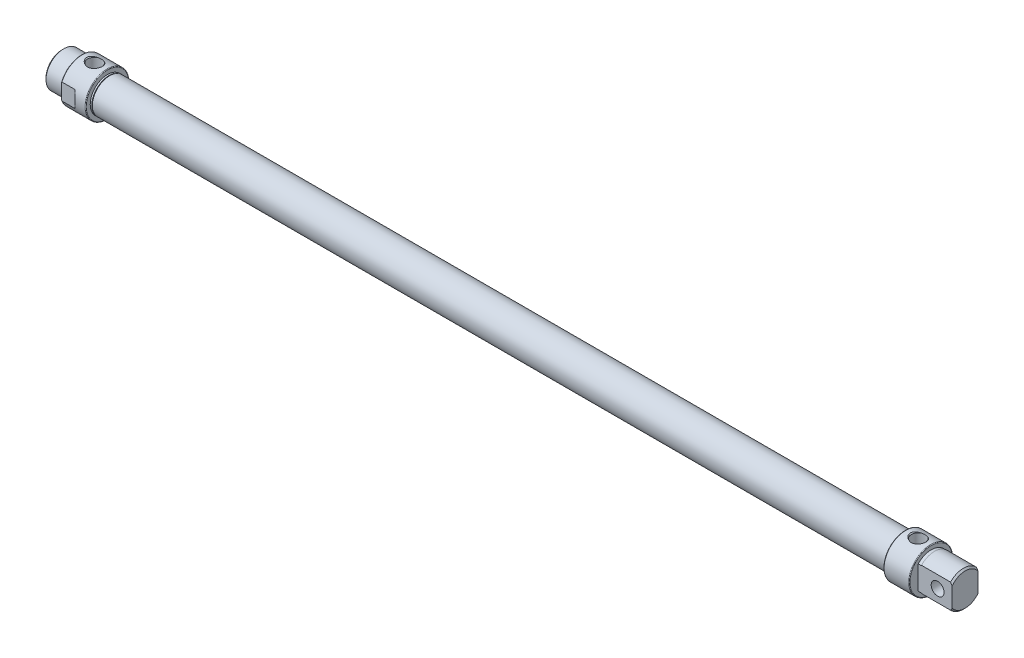
from build123d import *

# Parameters (mm, degrees)
SKETCH_3_W               = 36
SKETCH_3_H               = 42
SKETCH_3_W_2             = 16
SKETCH_3_H_2             = 22
CUT_EXTRUDE_1_DEPTH      = 21
SKETCH_4_W               = 16
SKETCH_4_H               = 4
CUT_EXTRUDE_2_DEPTH      = 27
CUT_EXTRUDE_2_DEPTH_BACK = 27


with BuildPart() as part:
    # 草图1 → 旋转1 (revolve)
    with BuildSketch(Plane.XY):
        with BuildLine():
            Line((0, 0), (0, 10.08))
            Line((0, 10.08), (0.92, 11))
            Line((0.92, 11), (12, 11))
            Line((12, 11), (12, 13.1))
            ThreePointArc((12, 13.1), (12.117157288, 13.382842712), (12.4, 13.5))
            Line((12.4, 13.5), (27.6, 13.5))
            ThreePointArc((27.6, 13.5), (27.882842712, 13.382842712), (28, 13.1))
            Line((28, 13.1), (28, 10.7))
            Line((28, 10.7), (29, 10.7))
            Line((29, 10.7), (29, 10.2))
            Line((29, 10.2), (29.3, 10.7))
            Line((29.3, 10.7), (520.7, 10.7))
            Line((520.7, 10.7), (521, 10.2))
            Line((521, 10.2), (521, 10.7))
            Line((521, 10.7), (522, 10.7))
            Line((522, 10.7), (522, 13.1))
            ThreePointArc((522, 13.1), (522.117157288, 13.382842712), (522.4, 13.5))
            Line((522.4, 13.5), (537.6, 13.5))
            ThreePointArc((537.6, 13.5), (537.882842712, 13.382842712), (538, 13.1))
            Line((538, 13.1), (538, 0))
            Line((538, 0), (0, 0))
        make_face()
    revolve(axis=Axis((538, 0, 0), (-1, 0, 0)))

    # 草图2 → 旋转2 (revolve)
    with BuildSketch(Plane.XY):
        Polygon((538, 0), (538, 10.85), (540, 10.85), (540, 11), (558, 11), (559, 10), (559, 0), align=None)
    revolve(axis=Axis((559, 0, 0), (-1, 0, 0)))

    # 草图3 → 切除-拉伸1 (cut)
    with BuildSketch(Plane(origin=(559, 0, 0), x_dir=(0, 0, -1), z_dir=(1, 0, 0))):
        Rectangle(SKETCH_3_W, SKETCH_3_H)
        Rectangle(SKETCH_3_W_2, SKETCH_3_H_2, mode=Mode.SUBTRACT)
    extrude(amount=-CUT_EXTRUDE_1_DEPTH, mode=Mode.SUBTRACT)

    # 草图4 → 切除-旋转1 (revolve, cut)
    with BuildSketch(Plane(origin=(550, 0, 0), x_dir=(0, 0, -1), z_dir=(1, 0, 0))):
        with Locations((0, 2)):
            Rectangle(SKETCH_4_W, SKETCH_4_H)
    revolve(axis=Axis((550, 0, -8), (0, 0, 1)), mode=Mode.SUBTRACT)

    # 草图5 → 切除-旋转2 (revolve, cut)
    with BuildSketch(Plane.XY):
        Polygon((20, 13.5), (24.864, 13.5), (24.283, 12.919), (24.283, 5.5), (20, 5.5), align=None)
    revolve(axis=Axis((20, 5.5, 0), (0, 1, 0)), mode=Mode.SUBTRACT)

    # 草图6 → 切除-旋转3 (revolve, cut)
    with BuildSketch(Plane.XY):
        Polygon((530, 13.5), (534.864, 13.5), (534.283, 12.919), (534.283, 5.5), (530, 5.5), align=None)
    revolve(axis=Axis((530, 5.5, 0), (0, 1, 0)), mode=Mode.SUBTRACT)

    # 草图7 → 切除-拉伸2 (cut, two sides: drawn at the far end of the back side and taken through both)
    with BuildSketch(Plane(origin=(0, 0, 0), x_dir=(1, 0, 0), z_dir=(0, 1, 0)).offset(-CUT_EXTRUDE_2_DEPTH_BACK)):
        Polygon((-4, -13.5), (21.5, -13.5), (20.5, -12.5), (-2, -12.5), (-2, 12.5), (20.5, 12.5), (21.5, 13.5), (-4, 13.5), align=None)
    extrude(amount=CUT_EXTRUDE_2_DEPTH + CUT_EXTRUDE_2_DEPTH_BACK, mode=Mode.SUBTRACT)

    # 草图8 → 切除-旋转4 (revolve, cut)
    with BuildSketch(Plane.XY):
        Polygon((0, 0), (0, 4), (39, 4), (39, 10), (511, 10), (511, 0), align=None)
    revolve(axis=Axis((511, 0, 0), (-1, 0, 0)), mode=Mode.SUBTRACT)


solid = part.part
